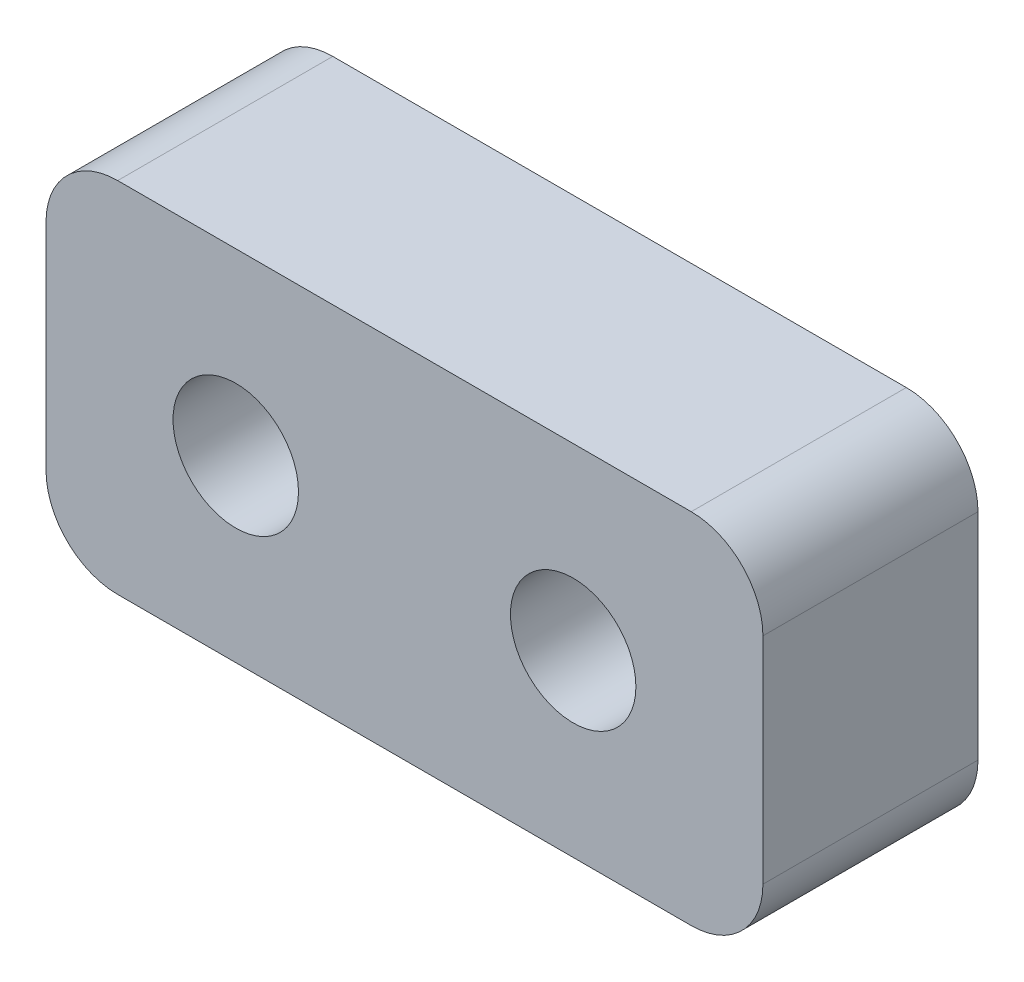
from build123d import *

# Parameters (mm, degrees)
CROQUIS1_W              = 40
CROQUIS1_H              = 20
SALIENTE_EXTRUIR1_DEPTH = 12
REDONDEO1_R             = 4
CROQUIS2_R              = 2.5
CORTAR_EXTRUIR1_DEPTH   = 8
CROQUIS3_R              = 3.5
CORTAR_EXTRUIR2_DEPTH   = 10
CROQUIS4_R              = 2
CORTAR_EXTRUIR3_DEPTH   = 2


with BuildPart() as part:
    # Croquis1 → Saliente-Extruir1 (new body)
    with BuildSketch(Plane.XY):
        Rectangle(CROQUIS1_W, CROQUIS1_H)
    extrude(amount=SALIENTE_EXTRUIR1_DEPTH)

    # Redondeo1
    redondeo1_edges = [part.edges().sort_by_distance(p)[0] for p in [
        (20, -10, 6),
        (-20, -10, 6),
        (-20, 10, 6),
        (20, 10, 6),
    ]]
    fillet(redondeo1_edges, radius=REDONDEO1_R)

    # Croquis2 → Cortar-Extruir1 (cut)
    with BuildSketch(Plane(origin=(0, 0, 0), x_dir=(-1, 0, 0), z_dir=(0, 0, -1))):
        Circle(CROQUIS2_R)
    extrude(amount=-CORTAR_EXTRUIR1_DEPTH, mode=Mode.SUBTRACT)

    # Croquis3 → Cortar-Extruir2 (cut)
    with BuildSketch(Plane.XY.offset(12)):
        with Locations((-9.41266553, 0)):
            Circle(CROQUIS3_R)
        with Locations((9.41266553, 0)):
            Circle(CROQUIS3_R)
    extrude(amount=-CORTAR_EXTRUIR2_DEPTH, mode=Mode.SUBTRACT)

    # Croquis4 → Cortar-Extruir3 (cut)
    with BuildSketch(Plane.XY.offset(2)):
        with Locations((-9.41266553, 0)):
            Circle(CROQUIS4_R)
        with Locations((9.41266553, 0)):
            Circle(CROQUIS4_R)
    extrude(amount=-CORTAR_EXTRUIR3_DEPTH, mode=Mode.SUBTRACT)


solid = part.part
